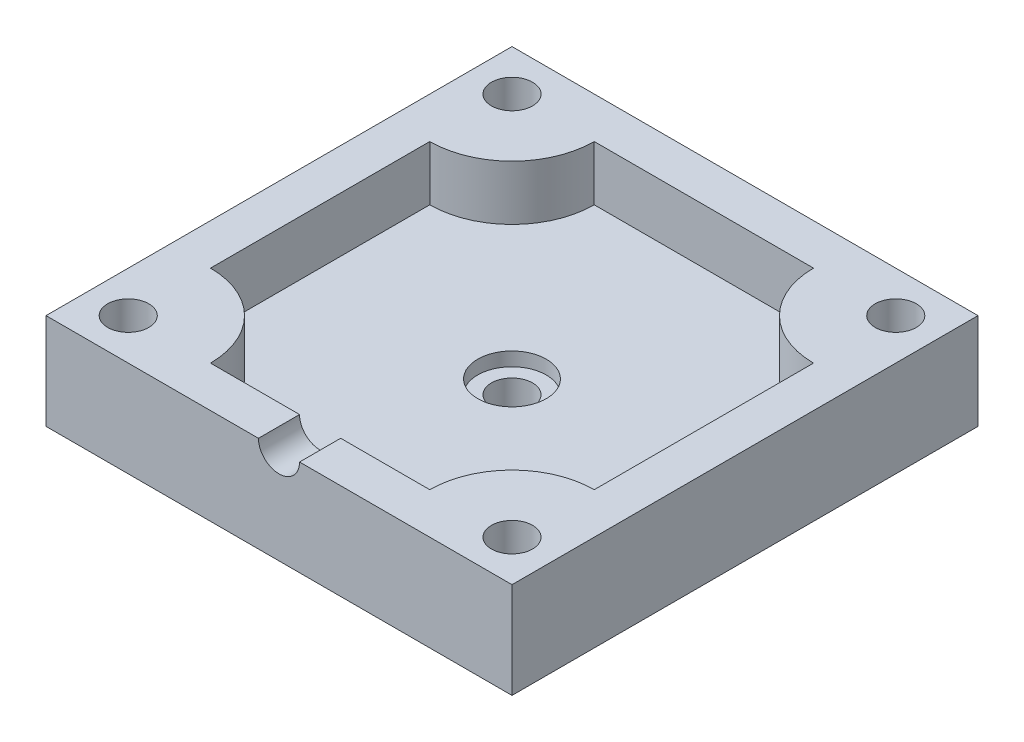
from build123d import *

# Parameters (mm, degrees)
SKETCH1_W           = 34
SKETCH1_H           = 34
BOSS_EXTRUDE1_DEPTH = 7
CUT_EXTRUDE1_DEPTH  = 4
SKETCH3_R           = 1.5
CUT_EXTRUDE2_DEPTH  = 10
SKETCH4_R           = 1.5
CUT_EXTRUDE3_DEPTH  = 10
SKETCH5_R           = 1.5
CUT_EXTRUDE4_DEPTH  = 10
SKETCH6_R           = 2.5
CUT_EXTRUDE5_DEPTH  = 1


with BuildPart() as part:
    # Sketch1 → Boss-Extrude1 (new body)
    with BuildSketch(Plane(origin=(0, 0, 0), x_dir=(1, 0, 0), z_dir=(0, 1, 0))):
        Rectangle(SKETCH1_W, SKETCH1_H)
    extrude(amount=BOSS_EXTRUDE1_DEPTH)

    # Sketch2 → Cut-Extrude1 (cut)
    with BuildSketch(Plane(origin=(0, 7, 0), x_dir=(1, 0, 0), z_dir=(0, 1, 0))):
        with BuildLine():
            Line((8, 14), (-8, 14))
            ThreePointArc((-8, 14), (-9.757359313, 9.757359313), (-14, 8))
            Line((-14, 8), (-14, -8))
            ThreePointArc((-14, -8), (-9.757359313, -9.757359313), (-8, -14))
            Line((-8, -14), (8, -14))
            ThreePointArc((8, -14), (9.757359313, -9.757359313), (14, -8))
            Line((14, -8), (14, 8))
            ThreePointArc((14, 8), (9.757359313, 9.757359313), (8, 14))
        make_face()
    extrude(amount=-CUT_EXTRUDE1_DEPTH, mode=Mode.SUBTRACT)

    # Sketch3 → Cut-Extrude2 (cut)
    with BuildSketch(Plane.XY.offset(17)):
        with Locations((0, 7)):
            Circle(SKETCH3_R)
    extrude(amount=-CUT_EXTRUDE2_DEPTH, mode=Mode.SUBTRACT)

    # Sketch4 → Cut-Extrude3 (cut)
    with BuildSketch(Plane(origin=(0, 7, 0), x_dir=(1, 0, 0), z_dir=(0, 1, 0))):
        with Locations(Location((-14, 14, 0), (0, 0, 270))):
            Circle(SKETCH4_R)
        with Locations(Location((14, 14, 0), (0, 0, 270))):
            Circle(SKETCH4_R)
        with Locations(Location((14, -14, 0), (0, 0, 270))):
            Circle(SKETCH4_R)
        with Locations(Location((-14, -14, 0), (0, 0, 270))):
            Circle(SKETCH4_R)
    extrude(amount=-CUT_EXTRUDE3_DEPTH, mode=Mode.SUBTRACT)

    # Sketch5 → Cut-Extrude4 (cut)
    with BuildSketch(Plane(origin=(0, 3, 0), x_dir=(1, 0, 0), z_dir=(0, 1, 0))):
        with Locations(Location((0, 0, 0), (0, 0, 270))):
            Circle(SKETCH5_R)
    extrude(amount=-CUT_EXTRUDE4_DEPTH, mode=Mode.SUBTRACT)

    # Sketch6 → Cut-Extrude5 (cut)
    with BuildSketch(Plane(origin=(0, 3, 0), x_dir=(1, 0, 0), z_dir=(0, 1, 0))):
        with Locations(Location((0, 0, 0), (0, 0, 270))):
            Circle(SKETCH6_R)
    extrude(amount=-CUT_EXTRUDE5_DEPTH, mode=Mode.SUBTRACT)


solid = part.part
